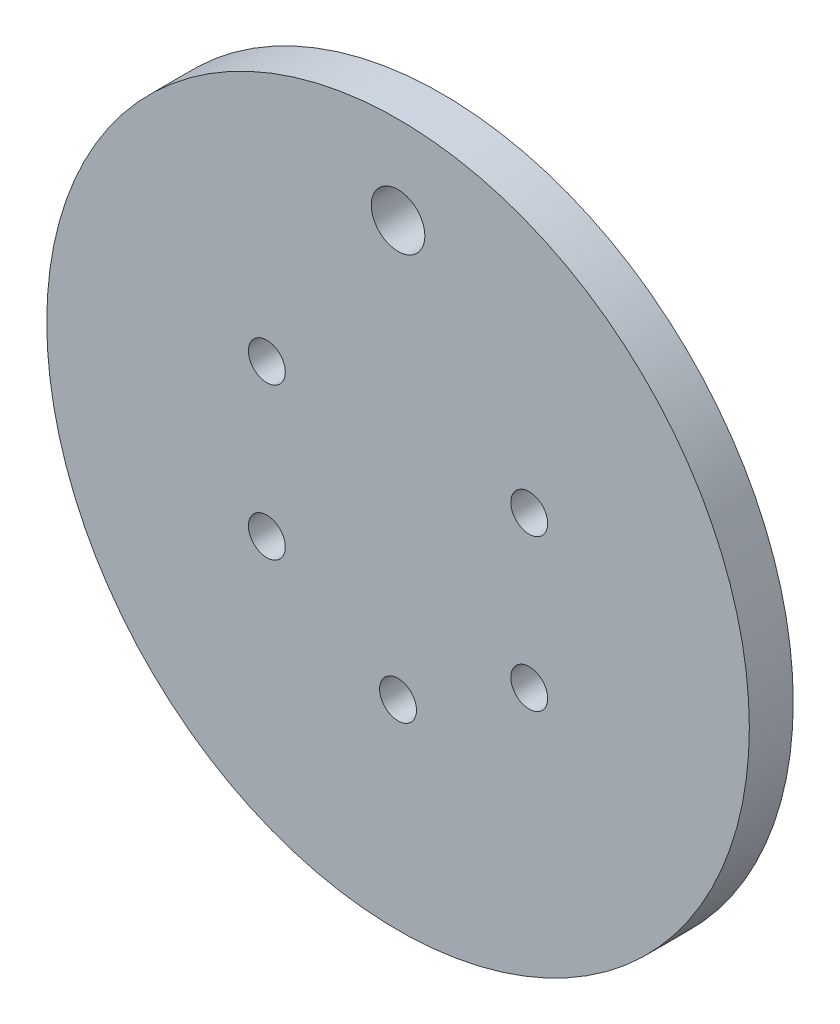
from build123d import *

# Parameters (mm, degrees)
SKETCH_1_R          = 40
SKETCH_1_R_2        = 2.1
EXTRUDE_1_DEPTH     = 5
SKETCH_2_R          = 3.05
CUT_EXTRUDE_2_DEPTH = 10


with BuildPart() as part:
    # 草图1 → 凸台-拉伸1 (new body)
    with BuildSketch(Plane.XY):
        Circle(SKETCH_1_R)
        with Locations((14.938938215, 8.625)):
            Circle(SKETCH_1_R_2, mode=Mode.SUBTRACT)
        with Locations((14.938938215, -8.625)):
            Circle(SKETCH_1_R_2, mode=Mode.SUBTRACT)
        with Locations((0, -17.25)):
            Circle(SKETCH_1_R_2, mode=Mode.SUBTRACT)
        with Locations((-14.938938215, -8.625)):
            Circle(SKETCH_1_R_2, mode=Mode.SUBTRACT)
        with Locations((-14.938938215, 8.625)):
            Circle(SKETCH_1_R_2, mode=Mode.SUBTRACT)
    extrude(amount=EXTRUDE_1_DEPTH)

    # 草图2 → 切除-拉伸2 (cut)
    with BuildSketch(Plane.XY.offset(5)):
        with Locations((0, 30)):
            Circle(SKETCH_2_R)
    extrude(amount=-CUT_EXTRUDE_2_DEPTH, mode=Mode.SUBTRACT)


solid = part.part
